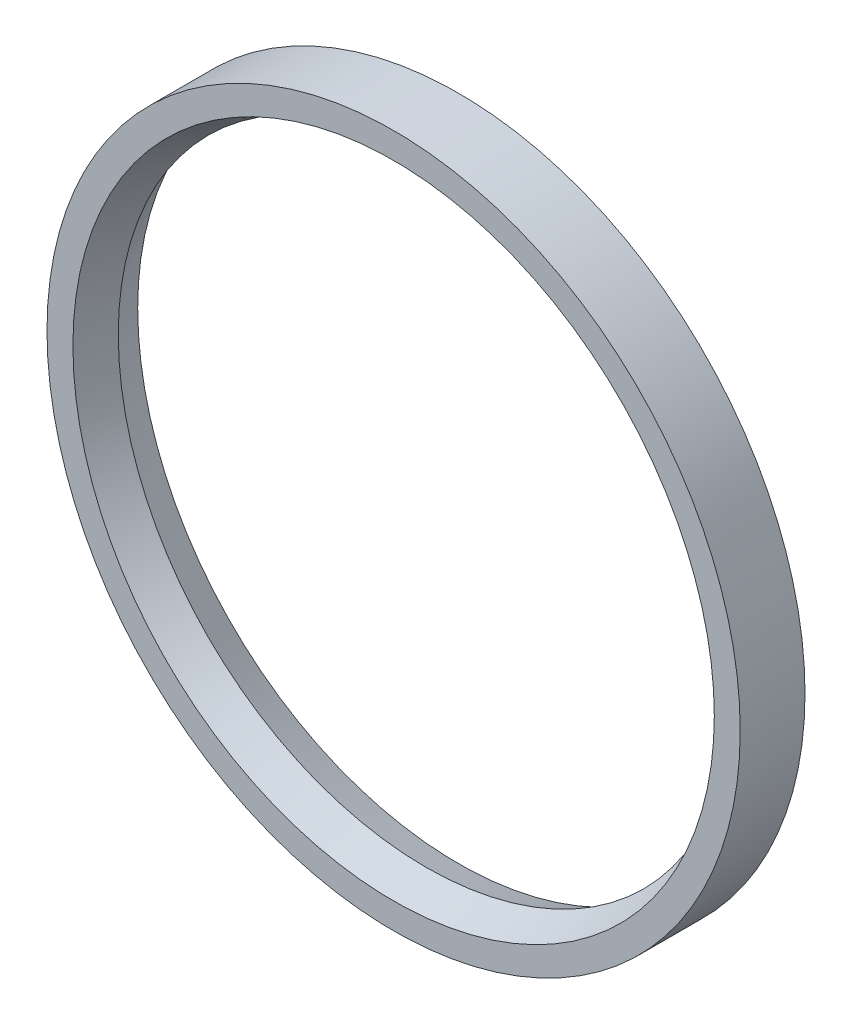
from build123d import *


with BuildPart() as part:
    # Sketch1 → Revolve1 (revolve)
    with BuildSketch(Plane(origin=(0, 0, 0), x_dir=(0, 0, -1), z_dir=(1, 0, 0)), mode=Mode.PRIVATE) as revolve1_sk:
        Polygon((0, 0), (2.5, -1), (5, 0), (5, 2), (0, 2), align=None)
    revolve(revolve1_sk.sketch.rotate(Axis((0, -24.75, 0), (0, 0, -1)), 90), axis=Axis((0, -24.75, 0), (0, 0, -1)))


solid = part.part
